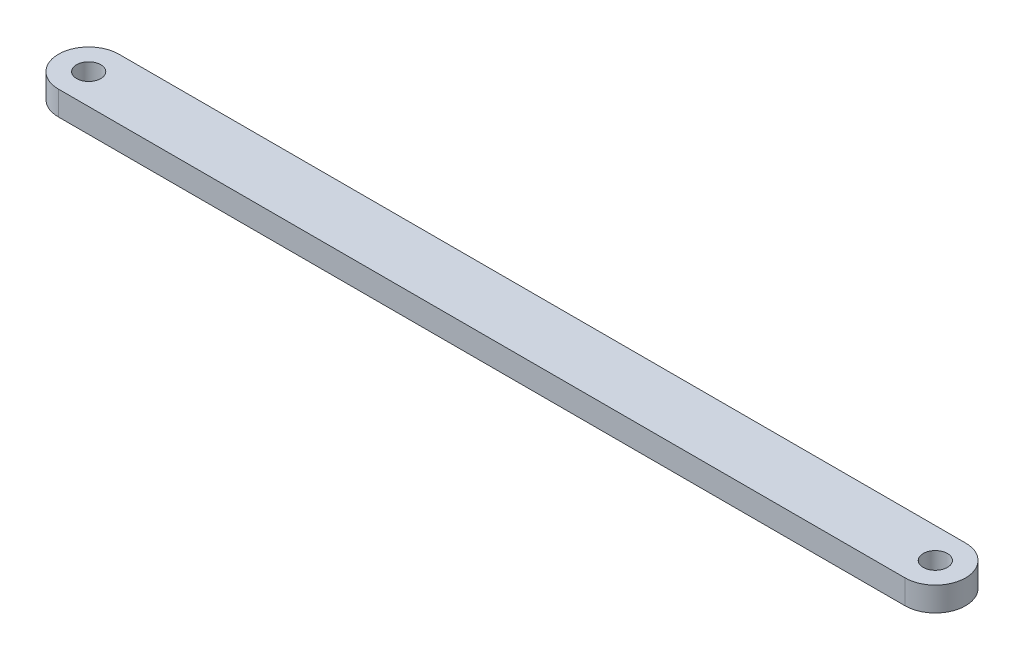
from build123d import *

# Parameters (mm, degrees)
SKETCH1_R           = 1
BOSS_EXTRUDE1_DEPTH = 2


with BuildPart() as part:
    # Sketch1 → Boss-Extrude1 (new body)
    with BuildSketch(Plane(origin=(0, 0, 0), x_dir=(1, 0, 0), z_dir=(0, 1, 0))):
        with BuildLine():
            Line((-10, 2.5), (60, 2.5))
            ThreePointArc((60, 2.5), (62.5, 0), (60, -2.5))
            Line((60, -2.5), (-10, -2.5))
            ThreePointArc((-10, -2.5), (-12.5, 0), (-10, 2.5))
        make_face()
        with Locations(Location((60, 0, 0), (0, 0, 270))):
            Circle(SKETCH1_R, mode=Mode.SUBTRACT)
        with Locations(Location((-10, 0, 0), (0, 0, 270))):
            Circle(SKETCH1_R, mode=Mode.SUBTRACT)
    extrude(amount=BOSS_EXTRUDE1_DEPTH)


solid = part.part
